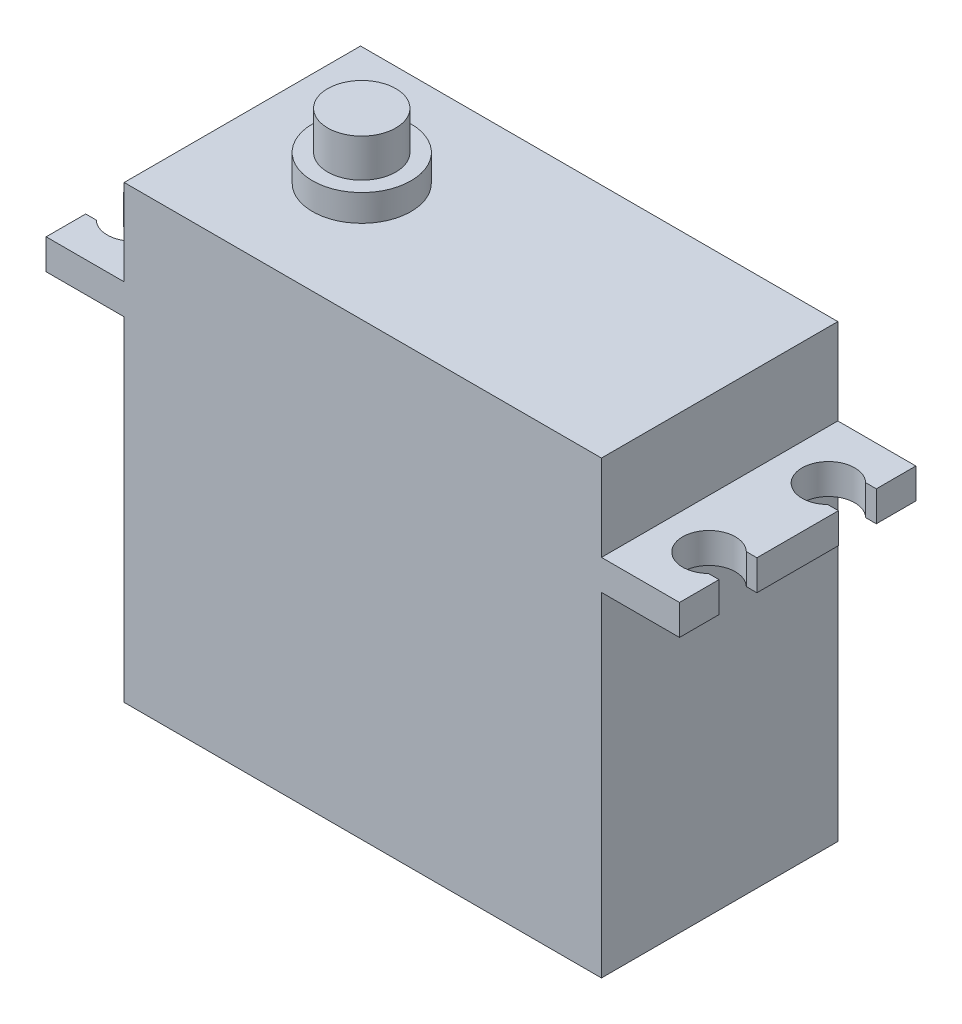
from build123d import *

# Parameters (mm, degrees)
SKETCH1_W           = 40.005
SKETCH1_H           = 19.812
BOSS_EXTRUDE1_DEPTH = 37.7444
SKETCH2_R           = 4.1275
BOSS_EXTRUDE2_DEPTH = 2.2352
SKETCH3_R           = 2.8575
BOSS_EXTRUDE3_DEPTH = 3.2004
BOSS_EXTRUDE4_START = -27.9908
BOSS_EXTRUDE4_DEPTH = 2.54


with BuildPart() as part:
    # Sketch1 → Boss-Extrude1 (new body)
    with BuildSketch(Plane(origin=(0, 0, 0), x_dir=(1, 0, 0), z_dir=(0, 1, 0))):
        with Locations((20.0025, 9.906)):
            Rectangle(SKETCH1_W, SKETCH1_H)
    extrude(amount=BOSS_EXTRUDE1_DEPTH)

    # Sketch2 → Boss-Extrude2 (add)
    with BuildSketch(Plane(origin=(0, 37.7444, 0), x_dir=(1, 0, 0), z_dir=(0, 1, 0))):
        with Locations(Location((10.0076, 9.906, 0), (0, 0, 90))):
            Circle(SKETCH2_R)
    extrude(amount=BOSS_EXTRUDE2_DEPTH)

    # Sketch3 → Boss-Extrude3 (add)
    with BuildSketch(Plane(origin=(0, 39.9796, 0), x_dir=(1, 0, 0), z_dir=(0, 1, 0))):
        with Locations(Location((10.0076, 9.906, 0), (0, 0, 270))):
            Circle(SKETCH3_R)
    extrude(amount=BOSS_EXTRUDE3_DEPTH)

    # Sketch4 → Boss-Extrude4 (add)
    with BuildSketch(Plane.XZ.offset(BOSS_EXTRUDE4_START)):
        with BuildLine():
            Line((0, 0), (-6.5405, 0))
            Line((-6.5405, 0), (-6.5405, -3.3147))
            Line((-6.5405, -3.3147), (-5.652024704, -3.3147))
            ThreePointArc((-5.652024704, -3.3147), (-1.905, -4.9022), (-5.652024704, -6.4897))
            Line((-5.652024704, -6.4897), (-6.5405, -6.4897))
            Line((-6.5405, -6.4897), (-6.5405, -13.3223))
            Line((-6.5405, -13.3223), (-5.652024704, -13.3223))
            ThreePointArc((-5.652024704, -13.3223), (-1.905, -14.9098), (-5.652024704, -16.4973))
            Line((-5.652024704, -16.4973), (-6.5405, -16.4973))
            Line((-6.5405, -16.4973), (-6.5405, -19.812))
            Line((-6.5405, -19.812), (0, -19.812))
            Line((0, -19.812), (0, 0))
        make_face()
        with BuildLine():
            Line((46.5455, -16.4973), (46.5455, -19.812))
            Line((46.5455, -19.812), (40.005, -19.812))
            Line((40.005, -19.812), (40.005, 0))
            Line((40.005, 0), (46.5455, 0))
            Line((46.5455, 0), (46.5455, -3.3147))
            Line((46.5455, -3.3147), (45.657024704, -3.3147))
            ThreePointArc((45.657024704, -3.3147), (41.91, -4.9022), (45.657024704, -6.4897))
            Line((45.657024704, -6.4897), (46.5455, -6.4897))
            Line((46.5455, -6.4897), (46.5455, -13.3223))
            Line((46.5455, -13.3223), (45.657024704, -13.3223))
            ThreePointArc((45.657024704, -13.3223), (41.91, -14.9098), (45.657024704, -16.4973))
            Line((45.657024704, -16.4973), (46.5455, -16.4973))
        make_face()
    extrude(amount=-BOSS_EXTRUDE4_DEPTH)


solid = part.part
